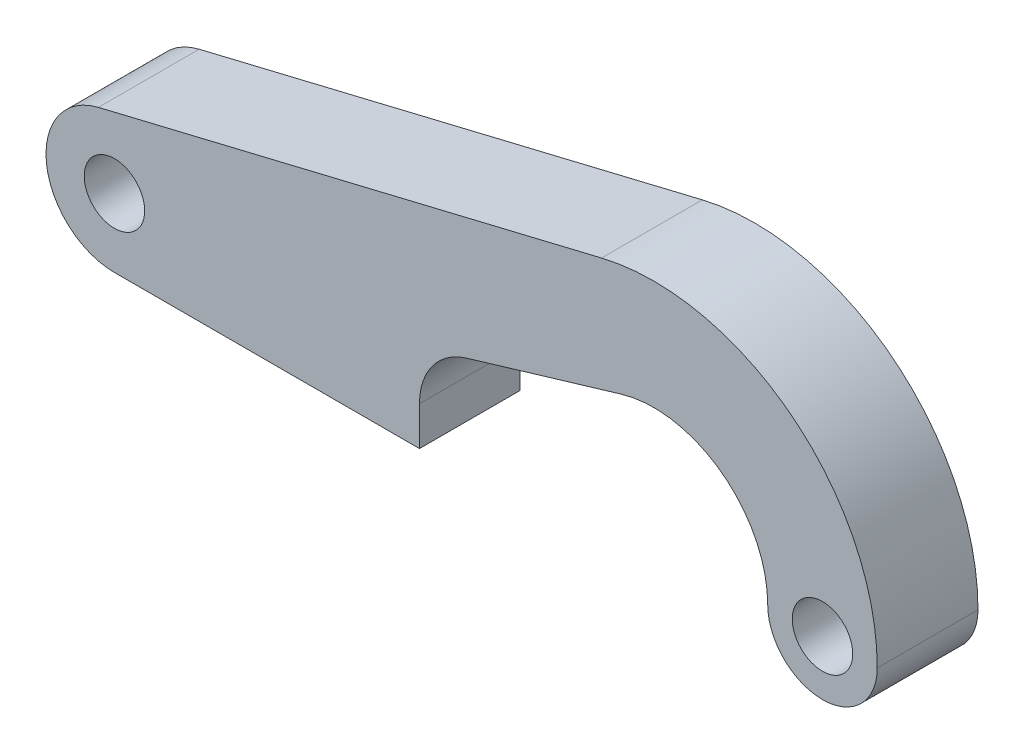
from build123d import *

# Parameters (mm, degrees)
SKETCH2_R           = 1.7526
BOSS_EXTRUDE1_DEPTH = 5.842
CUT_EXTRUDE1_DEPTH  = 47.691513729


with BuildPart() as part:
    # Sketch2 → Boss-Extrude1 (new body)
    with BuildSketch(Plane.XY.offset(2.794)):
        with BuildLine():
            Line((-0.928725161, 6.398554929), (28.242391074, 13.419823287))
            ThreePointArc((28.242391074, 13.419823287), (39.290541517, 11.000821605), (44.22775, 0.8255))
            ThreePointArc((44.22775, 0.8255), (41.05275, -2.3495), (37.87775, 0.8255))
            ThreePointArc((37.87775, 0.8255), (31.27375, 7.4295), (24.66975, 0.8255))
            Line((24.66975, 0.8255), (24.66975, -1.42875))
            Line((24.66975, -1.42875), (0, -1.42875))
            ThreePointArc((0, -1.42875), (-3.941104949, 2.072380128), (-0.928725161, 6.398554929))
        make_face()
        with Locations((0, 2.54)):
            Circle(SKETCH2_R, mode=Mode.SUBTRACT)
        with Locations((41.05275, 0.8255)):
            Circle(SKETCH2_R, mode=Mode.SUBTRACT)
    extrude(amount=BOSS_EXTRUDE1_DEPTH)

    # Sketch3 → Cut-Extrude1 (cut, through all)
    with BuildSketch(Plane.XY.offset(8.636)):
        with BuildLine():
            Line((37.87775, -10.052724244), (37.87775, 0.8255))
            ThreePointArc((37.87775, 0.8255), (35.220394868, 6.120479725), (29.386892857, 7.154211253))
            Line((29.386892857, 7.154211253), (20.406178571, 4.476679569))
            ThreePointArc((20.406178571, 4.476679569), (18.439954005, 3.102410501), (17.68475, 0.8255))
            Line((17.68475, 0.8255), (17.68475, -10.052724244))
            Line((17.68475, -10.052724244), (37.87775, -10.052724244))
        make_face()
    extrude(amount=-CUT_EXTRUDE1_DEPTH, mode=Mode.SUBTRACT)


solid = part.part
